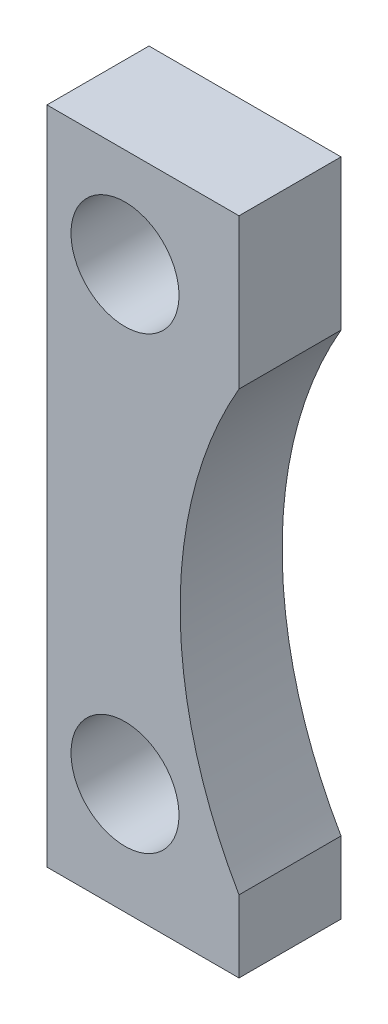
from build123d import *

# Parameters (mm, degrees)
Y_KSEKLIK_EKSTR_ZYON1_DEPTH = 8.5
IZIM2_R                     = 9
KES_EKSTR_ZYON1_DEPTH       = 116.814506863


with BuildPart() as part:
    # Çizim1 → Yükseklik-Ekstrüzyon1 (new, symmetric)
    with BuildSketch(Plane.XY):
        with BuildLine():
            Line((0, 110), (32, 110))
            Line((32, 110), (32, 85))
            ThreePointArc((32, 85), (22.190316578, 48.5), (32, 12))
            Line((32, 12), (32, 0))
            Line((32, 0), (0, 0))
            Line((0, 0), (0, 110))
        make_face()
    extrude(amount=Y_KSEKLIK_EKSTR_ZYON1_DEPTH, both=True)

    # Çizim2 → Kes-Ekstrüzyon1 (cut, through all)
    with BuildSketch(Plane(origin=(0, 0, -8.5), x_dir=(-1, 0, 0), z_dir=(0, 0, -1))):
        with Locations((-13, 93.5)):
            Circle(IZIM2_R)
        with Locations((-13, 18.5)):
            Circle(IZIM2_R)
    extrude(amount=-KES_EKSTR_ZYON1_DEPTH, mode=Mode.SUBTRACT)


solid = part.part
